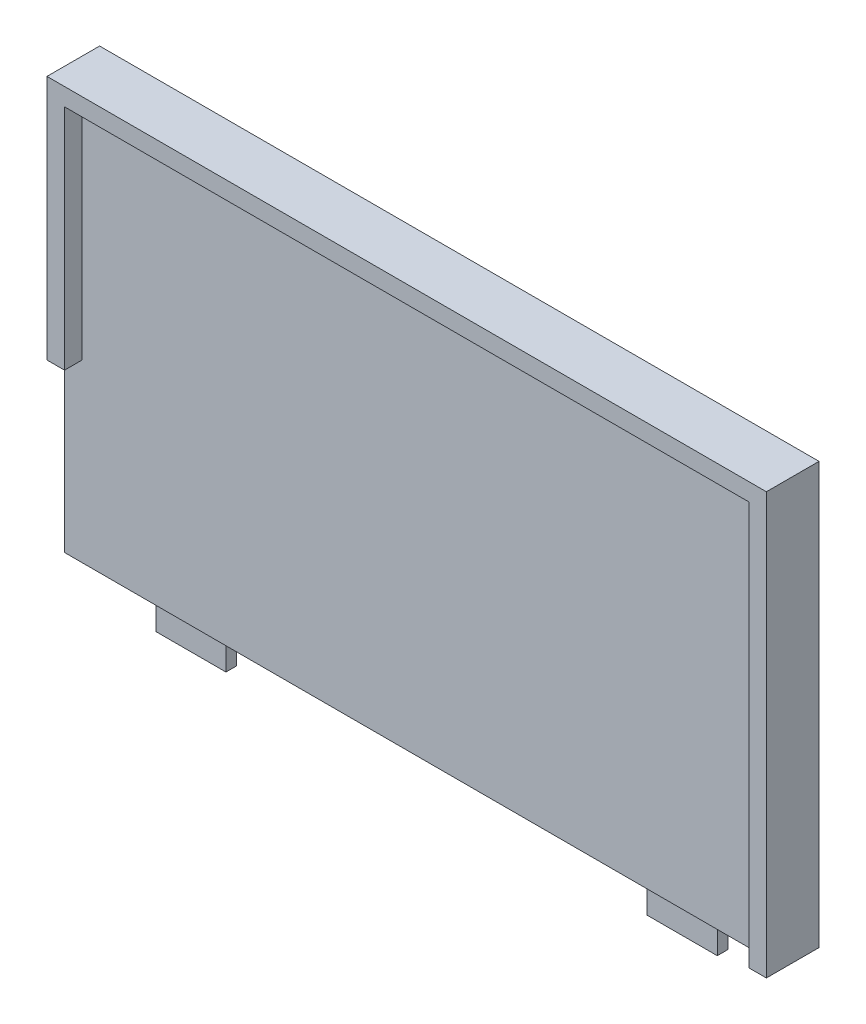
from build123d import *

# Parameters (mm, degrees)
SKETCH1_W           = 120
SKETCH1_H           = 205
BOSS_EXTRUDE1_DEPTH = 10
BOSS_EXTRUDE2_DEPTH = 5
SKETCH3_W           = 20.5
SKETCH3_H           = 3.5
CUT_EXTRUDE1_DEPTH  = 10
SKETCH4_W           = 20
SKETCH4_H           = 3
BOSS_EXTRUDE3_DEPTH = 10


with BuildPart() as part:
    # Sketch1 → Boss-Extrude1 (new body)
    with BuildSketch(Plane(origin=(0, 0, 0), x_dir=(0, 1, 0), z_dir=(0, 0, 1))):
        Rectangle(SKETCH1_W, SKETCH1_H)
    extrude(amount=BOSS_EXTRUDE1_DEPTH)

    # Sketch2 → Boss-Extrude2 (add)
    with BuildSketch(Plane.XY.offset(10)):
        Polygon((102.5, -60), (97.5, -60), (97.5, 55), (-97.5, 55), (-97.5, -10), (-102.5, -10), (-102.5, 60), (102.5, 60), align=None)
    extrude(amount=BOSS_EXTRUDE2_DEPTH)

    # Sketch3 → Cut-Extrude1 (cut)
    with BuildSketch(Plane(origin=(-102.5, 0, 0), x_dir=(0, -1, 0), z_dir=(-1, 0, 0))):
        with Locations((30, 5)):
            Rectangle(SKETCH3_W, SKETCH3_H)
    extrude(amount=-CUT_EXTRUDE1_DEPTH, mode=Mode.SUBTRACT)

    # Sketch4 → Boss-Extrude3 (add)
    with BuildSketch(Plane.XZ.offset(60)):
        with Locations((-70, 4.996334029)):
            Rectangle(SKETCH4_W, SKETCH4_H)
        with Locations((70, 4.996334029)):
            Rectangle(SKETCH4_W, SKETCH4_H)
    extrude(amount=BOSS_EXTRUDE3_DEPTH)


solid = part.part
